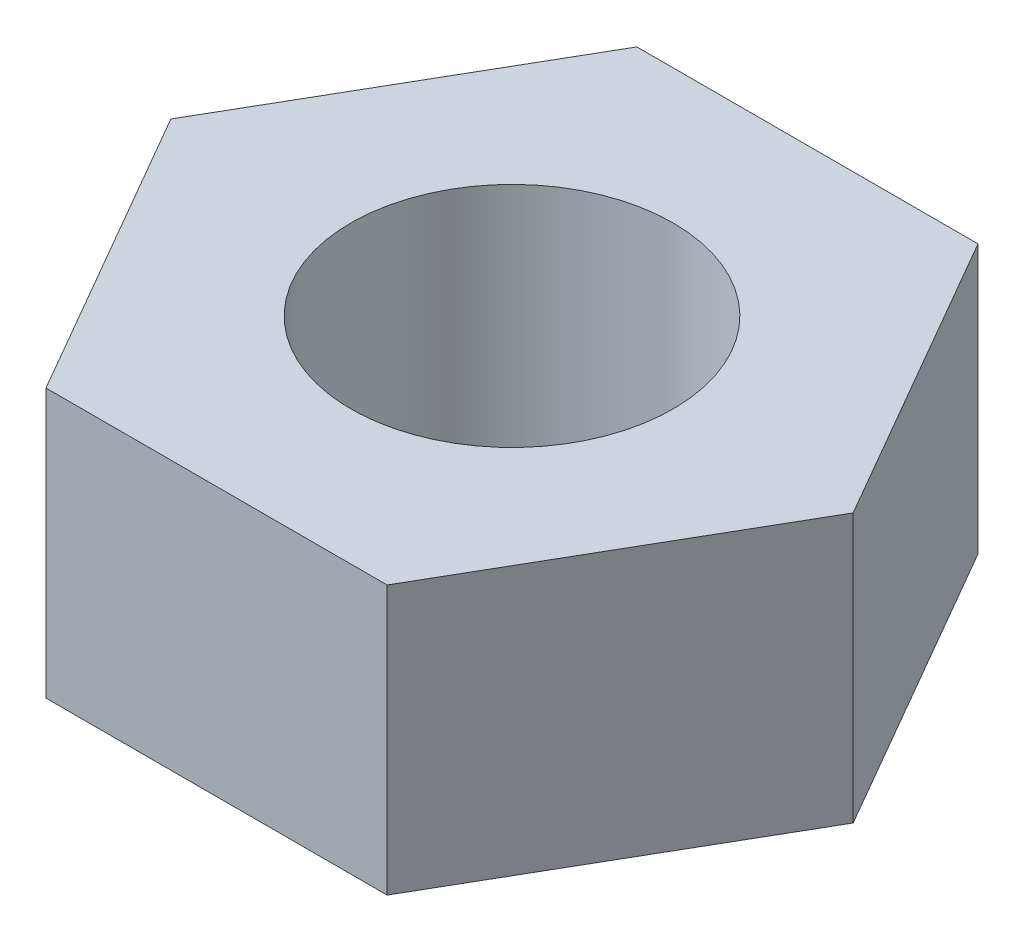
from build123d import *

# Parameters (mm, degrees)
EXTRUDE_1_DEPTH     = 2.5
SKETCH_3_R          = 1.5
CUT_EXTRUDE_1_DEPTH = 5.888336459


with BuildPart() as part:
    # 草图1 → 凸台-拉伸1 (new body)
    with BuildSketch(Plane(origin=(0, 0, 0), x_dir=(1, 0, 0), z_dir=(0, 1, 0))):
        Polygon((3.175426481, 0), (1.58771324, 2.75), (-1.58771324, 2.75), (-3.175426481, 0), (-1.58771324, -2.75), (1.58771324, -2.75), align=None)
    extrude(amount=EXTRUDE_1_DEPTH)

    # 草图3 → 切除-拉伸1 (cut, through all)
    with BuildSketch(Plane.XZ):
        Circle(SKETCH_3_R)
    extrude(amount=-CUT_EXTRUDE_1_DEPTH, mode=Mode.SUBTRACT)


solid = part.part
